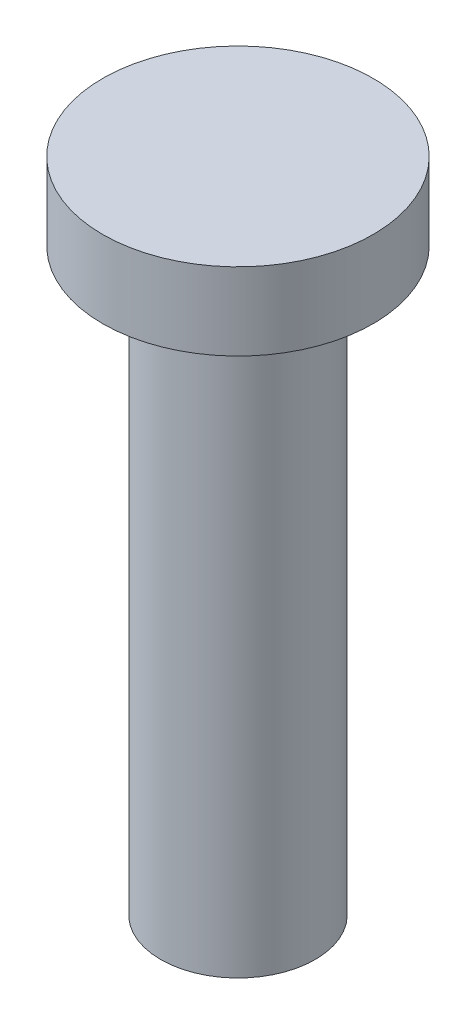
from build123d import *

# Parameters (mm, degrees)
ESQUISSE1_R      = 2
EXTRUSION1_DEPTH = 15
ESQUISSE2_R      = 3.5
EXTRUSION2_DEPTH = 2


with BuildPart() as part:
    # Esquisse1 → Extrusion1 (new body)
    with BuildSketch(Plane(origin=(0, 0, 0), x_dir=(1, 0, 0), z_dir=(0, 1, 0))):
        with Locations(Location((0, 0, 0), (0, 0, 270))):
            Circle(ESQUISSE1_R)
    extrude(amount=EXTRUSION1_DEPTH)

    # Esquisse2 → Extrusion2 (add)
    with BuildSketch(Plane(origin=(0, 15, 0), x_dir=(1, 0, 0), z_dir=(0, 1, 0))):
        with Locations(Location((0, 0, 0), (0, 0, 270))):
            Circle(ESQUISSE2_R)
    extrude(amount=EXTRUSION2_DEPTH)


solid = part.part
